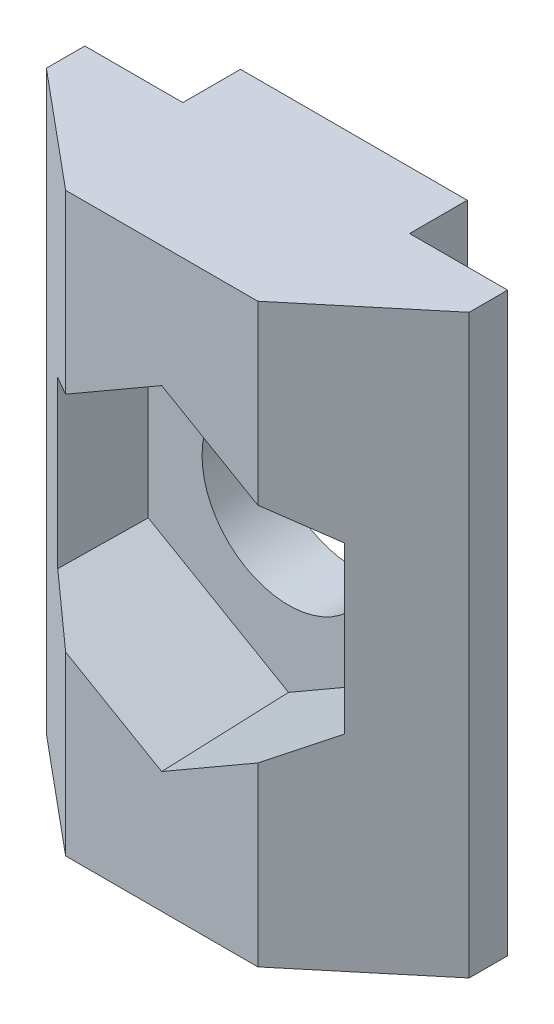
from build123d import *

# Parameters (mm, degrees)
BOSS_EXTRUDE1_DEPTH = 7.5
SKETCH2_R           = 2.25
CUT_EXTRUDE1_DEPTH  = 11.559356041
CUT_EXTRUDE2_START  = -3.3
CUT_EXTRUDE2_DEPTH  = 14.859356041
CUT_EXTRUDE2_DRAFT  = -2


with BuildPart() as part:
    # Sketch1 → Boss-Extrude1 (new, symmetric)
    with BuildSketch(Plane(origin=(0, 0, 0), x_dir=(1, 0, 0), z_dir=(0, 1, 0))):
        Polygon((-2.95, 0), (2.95, 0), (2.95, -1.5), (5.5, -1.5), (5.5, -2.5), (2.5, -5), (-2.5, -5), (-5.5, -2.5), (-5.5, -1.5), (-2.95, -1.5), align=None)
    extrude(amount=BOSS_EXTRUDE1_DEPTH, both=True)

    # Sketch2 → Cut-Extrude1 (cut, through all)
    with BuildSketch(Plane.XY.offset(5)):
        Circle(SKETCH2_R)
    extrude(amount=-CUT_EXTRUDE1_DEPTH, mode=Mode.SUBTRACT)


with BuildPart() as cut_extrude2_tool:
    # Sketch3 → Cut-Extrude2 (with draft: the straight prism first)
    with BuildSketch(Plane.XY.offset(5).offset(CUT_EXTRUDE2_START)):
        Polygon((0, 4.214656965), (-3.65, 2.107328483), (-3.65, -2.107328483), (0, -4.214656965), (3.65, -2.107328483), (3.65, 2.107328483), align=None)
    extrude(amount=CUT_EXTRUDE2_DEPTH)
    # Cut-Extrude2: the draft: its side faces are tilted about the plane it starts from
    cut_extrude2_sides = [cut_extrude2_tool.faces().sort_by_distance(p)[0] for p in [
        (-1.825, 3.160992724, 9.12967802),
        (-3.65, 0, 9.12967802),
        (-1.825, -3.160992724, 9.12967802),
        (1.825, -3.160992724, 9.12967802),
        (3.65, 0, 9.12967802),
        (1.825, 3.160992724, 9.12967802),
    ]]
    draft(cut_extrude2_sides, Plane.XY.offset(5).offset(CUT_EXTRUDE2_START), CUT_EXTRUDE2_DRAFT)


with BuildPart() as part_1:
    add(part.part)

    # Cut-Extrude2: cut by cut_extrude2_tool
    add(cut_extrude2_tool.part, mode=Mode.SUBTRACT)


solid = part_1.part
